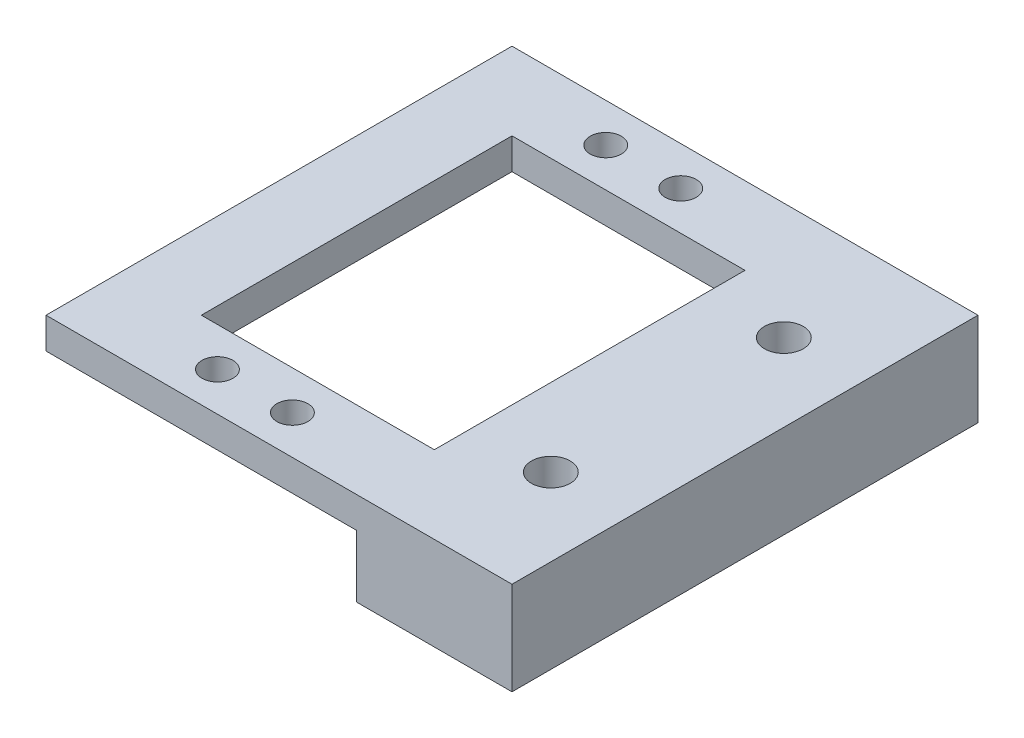
from build123d import *

# Parameters (mm, degrees)
SKETCH_1_W          = 20
SKETCH_1_H          = 60
EXTRUDE_1_DEPTH     = 8
EXTRUDE_2_DEPTH     = 4
SKETCH_4_W          = 10
SKETCH_4_H          = 60
EXTRUDE_3_DEPTH     = 4
SKETCH_5_R          = 2.5
CUT_EXTRUDE_1_DEPTH = 67
CUT_EXTRUDE_2_DEPTH = 10


with BuildPart() as part:
    # 草图1 → 凸台-拉伸1 (new body)
    with BuildSketch(Plane(origin=(0, 0, 0), x_dir=(1, 0, 0), z_dir=(0, 1, 0))):
        Rectangle(SKETCH_1_W, SKETCH_1_H)
    extrude(amount=EXTRUDE_1_DEPTH)

    # 草图3 → 凸台-拉伸2 (add)
    with BuildSketch(Plane(origin=(0, 8, 0), x_dir=(1, 0, 0), z_dir=(0, 1, 0))):
        Polygon((10, -30), (10, 30), (-50, 30), (-50, 20), (-10, 20), (-10, -20), (-50, -20), (-50, -30), align=None)
    extrude(amount=EXTRUDE_2_DEPTH)

    # 草图4 → 凸台-拉伸3 (add)
    with BuildSketch(Plane(origin=(0, 12, 0), x_dir=(1, 0, 0), z_dir=(0, 1, 0))):
        with Locations((-45, 0)):
            Rectangle(SKETCH_4_W, SKETCH_4_H)
    extrude(amount=-EXTRUDE_3_DEPTH)

    # 草图5 → 切除-拉伸1 (cut)
    with BuildSketch(Plane(origin=(0, 12, 0), x_dir=(1, 0, 0), z_dir=(0, 1, 0))):
        with Locations(Location((0, 15, 0), (0, 0, 270))):
            Circle(SKETCH_5_R)
        with Locations(Location((0, -15, 0), (0, 0, 270))):
            Circle(SKETCH_5_R)
    extrude(amount=-CUT_EXTRUDE_1_DEPTH, mode=Mode.SUBTRACT)

    # 草图7 → 切除-拉伸2 (cut)
    with BuildSketch(Plane.XZ.offset(-8)):
        with BuildLine():
            ThreePointArc((-21.275, 25), (-23.275, 27), (-25.275, 25))
            ThreePointArc((-25.275, 25), (-23.275, 23), (-21.275, 25))
        make_face()
        with BuildLine():
            ThreePointArc((-30.925, 25), (-32.925, 27), (-34.925, 25))
            ThreePointArc((-34.925, 25), (-32.925, 23), (-30.925, 25))
        make_face()
        with BuildLine():
            ThreePointArc((-25.275, -25), (-23.275, -27), (-21.275, -25))
            ThreePointArc((-21.275, -25), (-23.275, -23), (-25.275, -25))
        make_face()
        with BuildLine():
            ThreePointArc((-34.925, -25), (-32.925, -27), (-30.925, -25))
            ThreePointArc((-30.925, -25), (-32.925, -23), (-34.925, -25))
        make_face()
    extrude(amount=-CUT_EXTRUDE_2_DEPTH, mode=Mode.SUBTRACT)


solid = part.part
